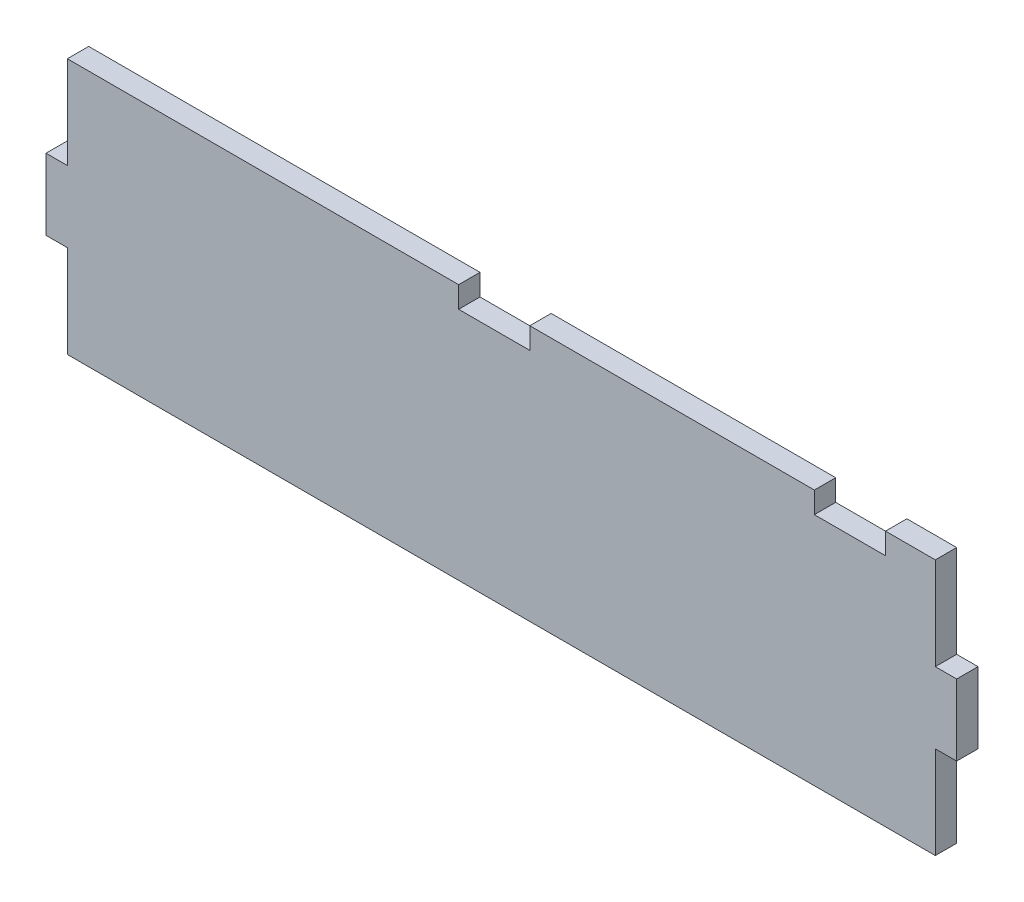
from build123d import *

# Parameters (mm, degrees)
EXTRUDE_1_DEPTH = 6


with BuildPart() as part:
    # Эскиз1 → Бобышка-Вытянуть1 (new body)
    with BuildSketch(Plane.XY):
        Polygon((0, 0), (0, 26), (-6, 26), (-6, 46), (0, 46), (0, 72), (110, 72), (110, 66), (130, 66), (130, 72), (210, 72), (210, 66), (230, 66), (230, 72), (244, 72), (244, 66), (244, 46), (250, 46), (250, 26), (244, 26), (244, 0), align=None)
    extrude(amount=EXTRUDE_1_DEPTH)


solid = part.part
